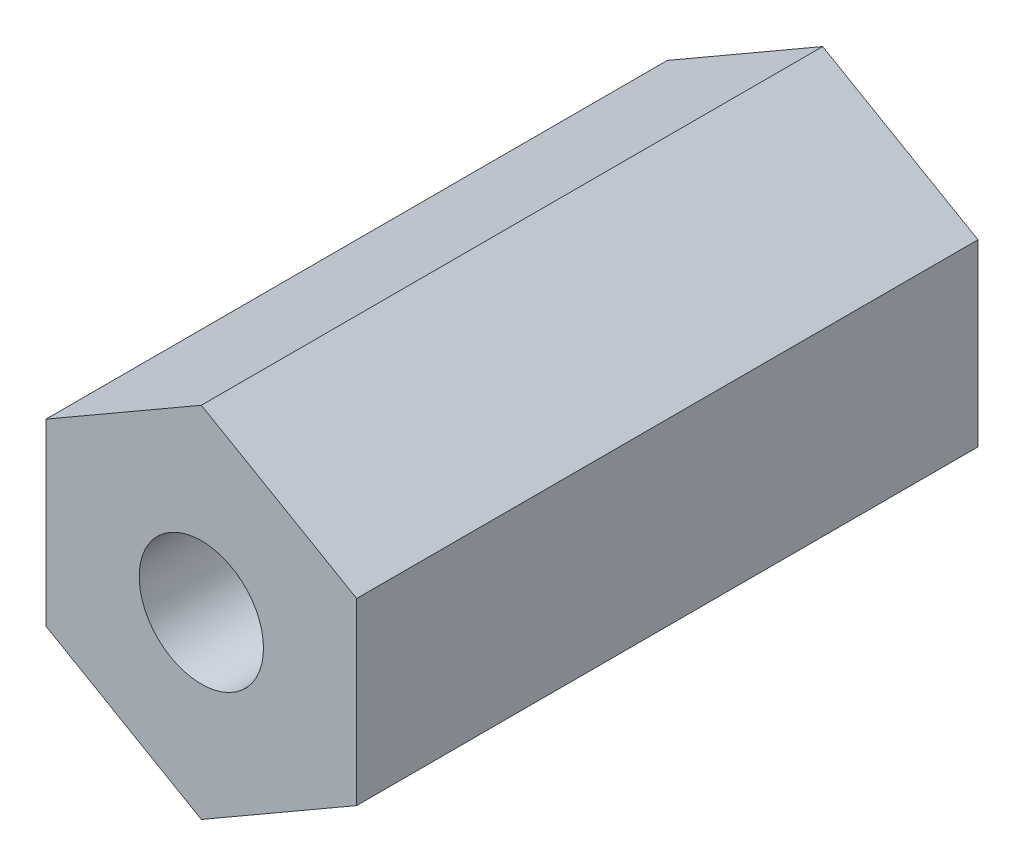
from build123d import *

# Parameters (mm, degrees)
BOSS_EXTRUDE1_DEPTH     = 12.7
CUT_EXTRUDE1_DEPTH      = 28.189075625
CUT_EXTRUDE1_DEPTH_BACK = 28.189075625
SKETCH2_R               = 2.54


with BuildPart() as part:
    # Sketch1 → Boss-Extrude1 (new, symmetric)
    with BuildSketch(Plane.XY):
        Polygon((6.35, 3.666174209), (0, 7.332348419), (-6.35, 3.666174209), (-6.35, -3.666174209), (0, -7.332348419), (6.35, -3.666174209), align=None)
    extrude(amount=BOSS_EXTRUDE1_DEPTH, both=True)

    # Sketch2 → Cut-Extrude1 (cut, two sides: drawn at the far end of the back side and taken through both)
    with BuildSketch(Plane.XY.offset(12.7).offset(-CUT_EXTRUDE1_DEPTH_BACK)):
        Circle(SKETCH2_R)
    extrude(amount=CUT_EXTRUDE1_DEPTH + CUT_EXTRUDE1_DEPTH_BACK, mode=Mode.SUBTRACT)


solid = part.part
